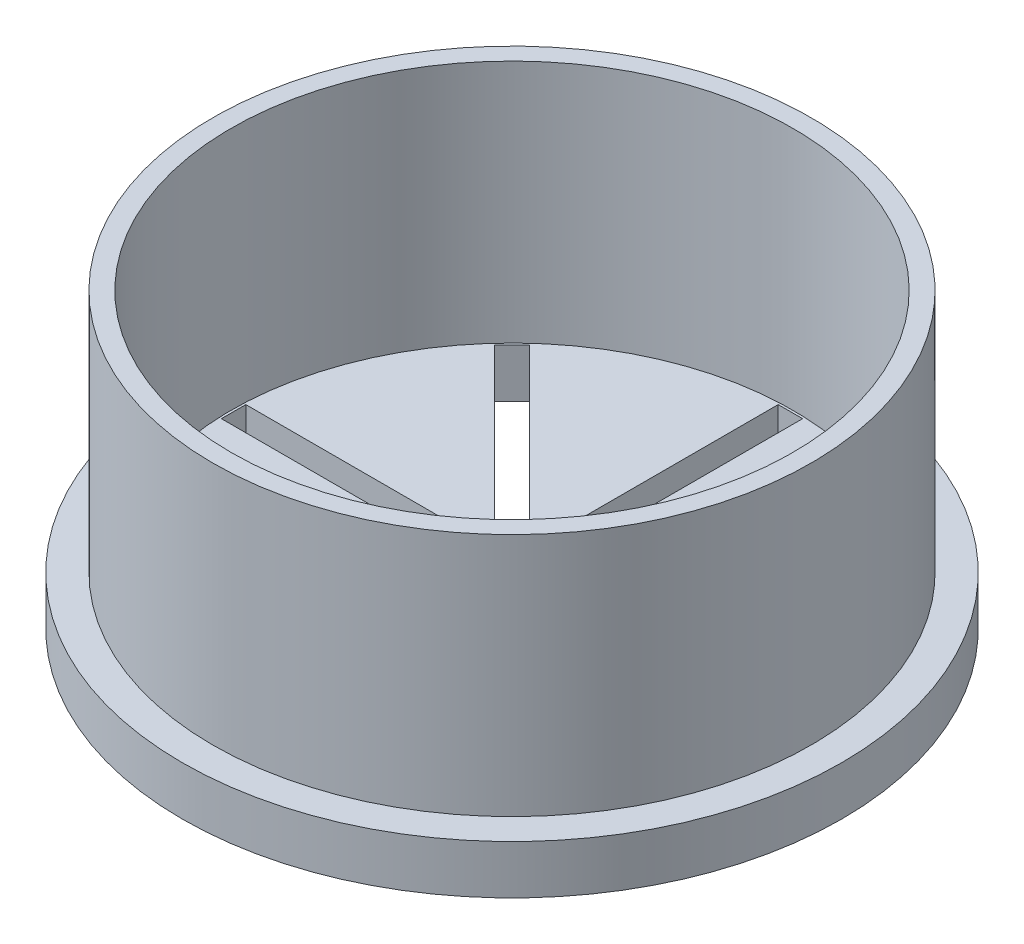
from build123d import *

# Parameters (mm, degrees)
SKETCH1_R           = 13.5
BOSS_EXTRUDE1_DEPTH = 2
SKETCH2_W           = 22.8
SKETCH2_H           = 1
SKETCH2_W_2         = 1
SKETCH2_H_2         = 22.8
CUT_EXTRUDE7_DEPTH  = 2
SKETCH3_R           = 12.25
BOSS_EXTRUDE2_DEPTH = 10
SKETCH4_R           = 11.5
CUT_EXTRUDE8_DEPTH  = 10


with BuildPart() as part:
    # Sketch1 → Boss-Extrude1 (new body)
    with BuildSketch(Plane(origin=(0, 0, 0), x_dir=(1, 0, 0), z_dir=(0, 1, 0))):
        Circle(SKETCH1_R)
    extrude(amount=BOSS_EXTRUDE1_DEPTH)

    # Sketch2 → Cut-Extrude7 (cut)
    with BuildSketch(Plane(origin=(0, 2, 0), x_dir=(1, 0, 0), z_dir=(0, 1, 0))):
        Polygon((-8.414570696, 7.707463915), (7.707463915, -8.414570696), (8.414570696, -7.707463915), (-7.707463915, 8.414570696), align=None)
        Rectangle(SKETCH2_W, SKETCH2_H)
        Rectangle(SKETCH2_W_2, SKETCH2_H_2)
        Polygon((7.707463915, 8.414570696), (-8.414570696, -7.707463915), (-7.707463915, -8.414570696), (8.414570696, 7.707463915), align=None)
    extrude(amount=-CUT_EXTRUDE7_DEPTH, mode=Mode.SUBTRACT)

    # Sketch3 → Boss-Extrude2 (add)
    with BuildSketch(Plane(origin=(0, 2, 0), x_dir=(1, 0, 0), z_dir=(0, 1, 0))):
        Circle(SKETCH3_R)
    extrude(amount=BOSS_EXTRUDE2_DEPTH)

    # Sketch4 → Cut-Extrude8 (cut)
    with BuildSketch(Plane(origin=(0, 12, 0), x_dir=(1, 0, 0), z_dir=(0, 1, 0))):
        Circle(SKETCH4_R)
    extrude(amount=-CUT_EXTRUDE8_DEPTH, mode=Mode.SUBTRACT)


solid = part.part
